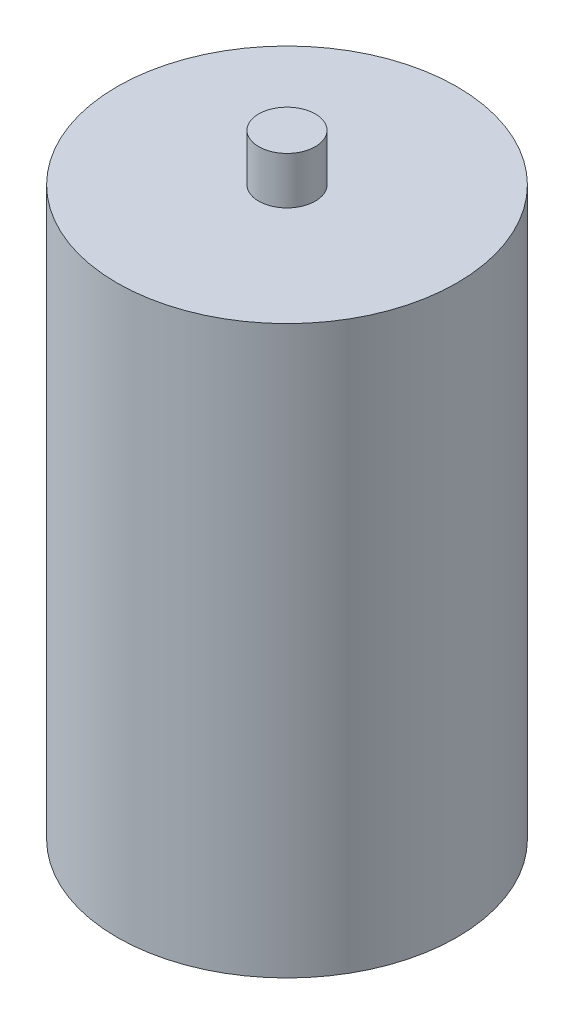
from build123d import *


with BuildPart() as part:
    # Esquisse2 → Révolution1 (revolve)
    with BuildSketch(Plane.XY, mode=Mode.PRIVATE) as r_volution1_sk:
        Polygon((0, 0), (3, 0), (3, 5), (18, 5), (18, 65), (3, 65), (3, 70), (0, 70), align=None)
    revolve(r_volution1_sk.sketch.rotate(Axis((0, 70, 0), (0, -1, 0)), 180), axis=Axis((0, 70, 0), (0, -1, 0)))


solid = part.part
